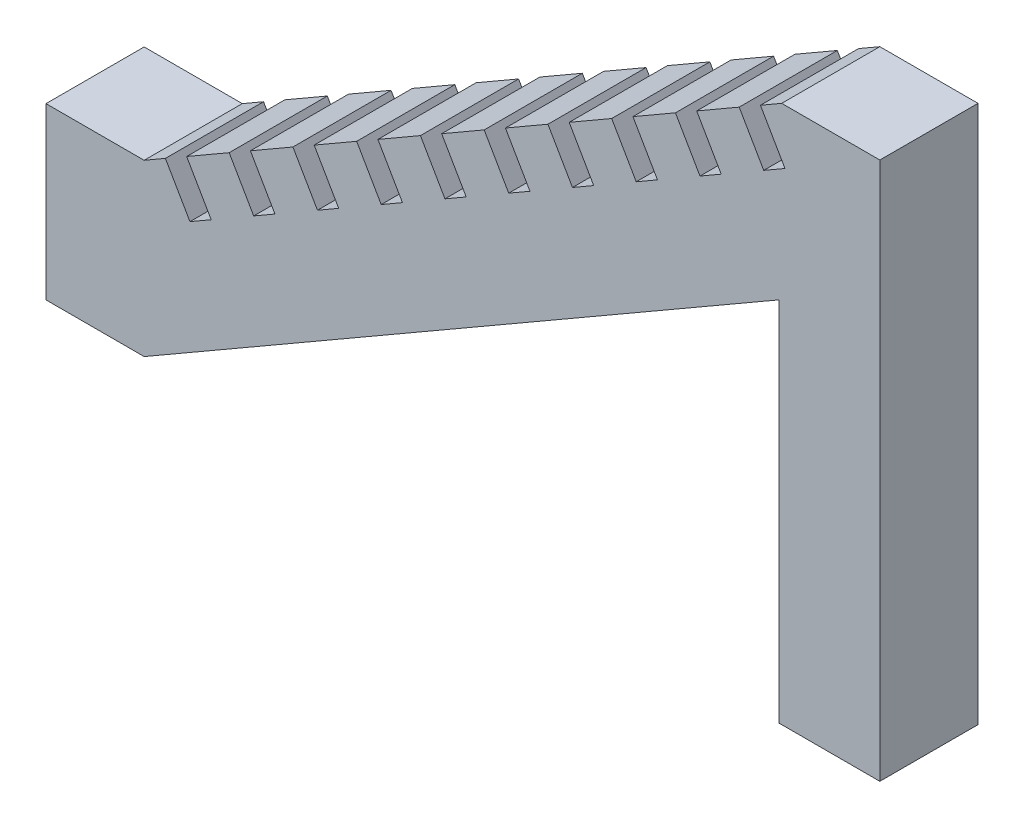
from build123d import *

# Parameters (mm, degrees)
BOSS_EXTRU_2_DEPTH      = 20
ESQUISSE4_W             = 5
ESQUISSE4_H             = 20
ENL_V_MAT_EXTRU_1_DEPTH = 10


with BuildPart() as part:
    # Esquisse2 → Boss.-Extru.2 (new body)
    with BuildSketch(Plane.XY):
        Polygon((0, 0), (-20, 0), (-20, 34.641016151), (0, 34.641016151), (129.903810568, 109.641016151), (149.903810568, 109.641016151), (149.903810568, 0), (129.37876344, 0), (129.37876344, 74.696863899), align=None)
    extrude(amount=BOSS_EXTRU_2_DEPTH)

    # Esquisse4 → Enlèv. mat.-Extru.1 (cut)
    with BuildSketch(Plane(origin=(-15, 25.980762114, 0), x_dir=(0.8660254037844379, 0.5000000000000013, 0), z_dir=(-0.5000000000000013, 0.8660254037844379, 0))):
        with Locations((24.820508076, -10)):
            Rectangle(ESQUISSE4_W, ESQUISSE4_H)
        with Locations((39.820508076, -10)):
            Rectangle(ESQUISSE4_W, ESQUISSE4_H)
        with Locations((54.820508076, -10)):
            Rectangle(ESQUISSE4_W, ESQUISSE4_H)
        with Locations((69.820508076, -10)):
            Rectangle(ESQUISSE4_W, ESQUISSE4_H)
        with Locations((84.820508076, -10)):
            Rectangle(ESQUISSE4_W, ESQUISSE4_H)
        with Locations((99.820508076, -10)):
            Rectangle(ESQUISSE4_W, ESQUISSE4_H)
        with Locations((114.820508076, -10)):
            Rectangle(ESQUISSE4_W, ESQUISSE4_H)
        with Locations((129.820508076, -10)):
            Rectangle(ESQUISSE4_W, ESQUISSE4_H)
        with Locations((144.820508076, -10)):
            Rectangle(ESQUISSE4_W, ESQUISSE4_H)
        with Locations((159.820508076, -10)):
            Rectangle(ESQUISSE4_W, ESQUISSE4_H)
    extrude(amount=-ENL_V_MAT_EXTRU_1_DEPTH, mode=Mode.SUBTRACT)


solid = part.part
